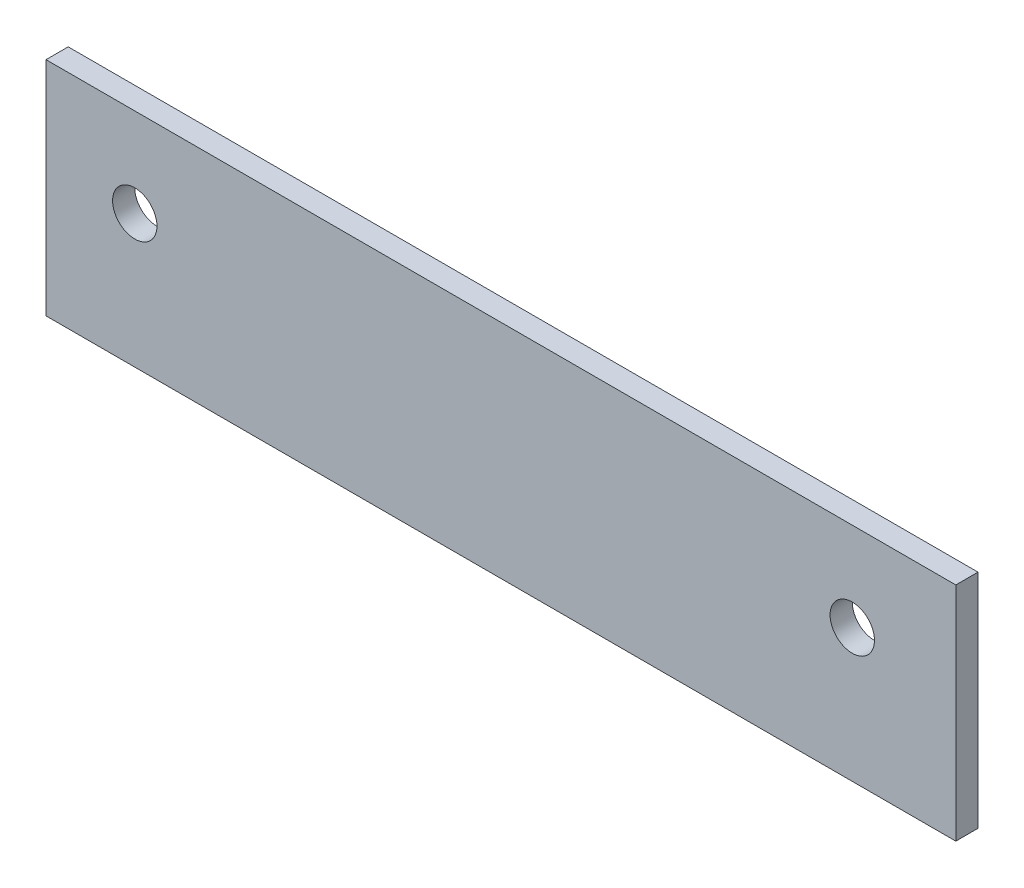
from build123d import *

# Parameters (mm, degrees)
ESQUISSE1_W      = 61.5
ESQUISSE1_H      = 15
EXTRUSION1_DEPTH = 1.5
ESQUISSE2_R      = 1.5
EXTRUSION2_DEPTH = 1.5


with BuildPart() as part:
    # Esquisse1 → Extrusion1 (new body)
    with BuildSketch(Plane.XY):
        with Locations((4.013966433, 8.543524416)):
            Rectangle(ESQUISSE1_W, ESQUISSE1_H)
    extrude(amount=EXTRUSION1_DEPTH)

    # Esquisse2 → Extrusion2 (cut)
    with BuildSketch(Plane.XY.offset(1.5)):
        with Locations((-20.736033567, 10.043524416)):
            Circle(ESQUISSE2_R)
        with Locations((27.763966433, 10.043524416)):
            Circle(ESQUISSE2_R)
    extrude(amount=-EXTRUSION2_DEPTH, mode=Mode.SUBTRACT)


solid = part.part
